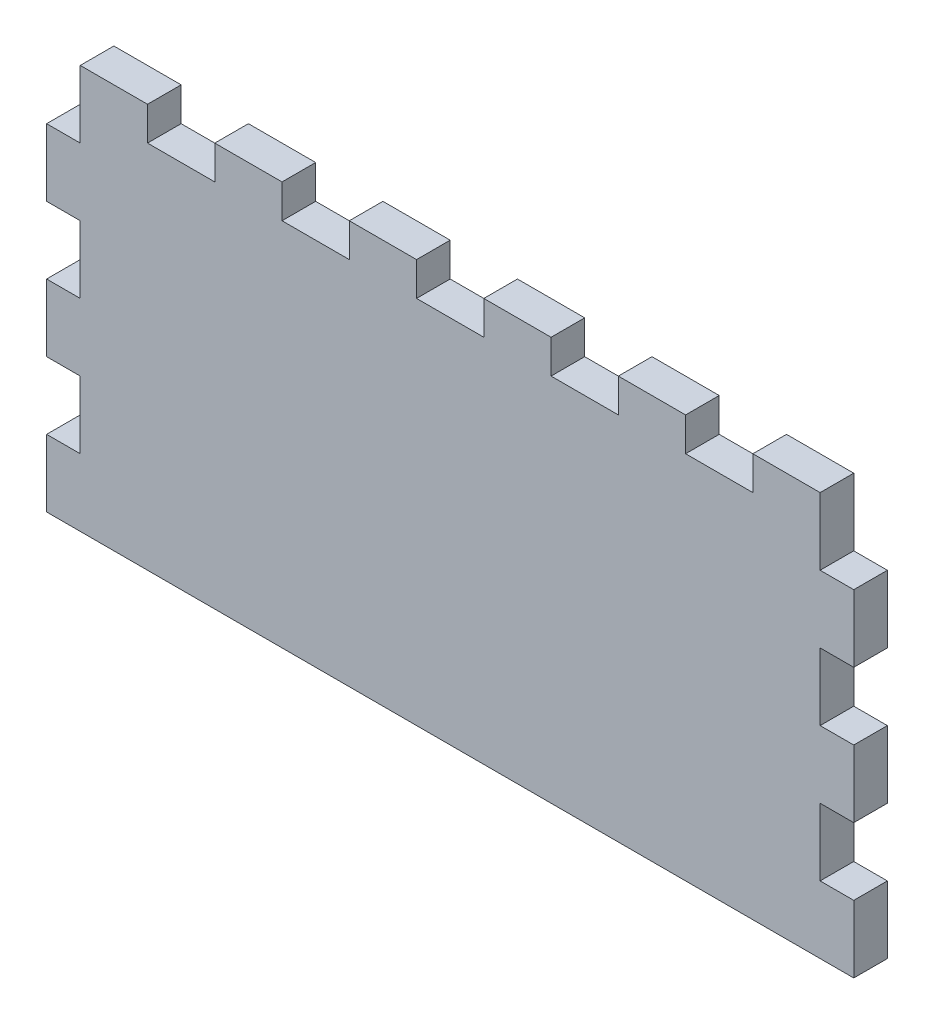
from build123d import *

# Parameters (mm, degrees)
SKETCH_1_W               = 120
SKETCH_1_H               = 60
EXTRUDE_1_DEPTH          = 5
CUT_EXTRUDE_1_REACH      = 69.268
SKETCH_2_W               = 5
SKETCH_2_H               = 10
PATTERN_LINEAR_1_COUNT   = 3
PATTERN_LINEAR_1_PITCH   = 20
MIRROR_1_COPY_1_REACH    = 69.268
MIRROR_1_COPY_1_SKETCH_W = 5
MIRROR_1_COPY_1_SKETCH_H = 10
MIRROR_1_COPY_2_REACH    = 69.268
MIRROR_1_COPY_2_SKETCH_W = 5
MIRROR_1_COPY_2_SKETCH_H = 10
CUT_EXTRUDE_2_REACH      = 69.268
SKETCH_3_W               = 10
SKETCH_3_H               = 5
PATTERN_LINEAR_2_COUNT   = 3
PATTERN_LINEAR_2_PITCH   = 20
PATTERN_LINEAR_3_COUNT   = 3
PATTERN_LINEAR_3_PITCH   = 20


with BuildPart() as part:
    # 스케치1 → 보스-돌출1 (new body)
    with BuildSketch(Plane.XY):
        Rectangle(SKETCH_1_W, SKETCH_1_H)
    extrude(amount=EXTRUDE_1_DEPTH)

    # 스케치2 → 컷-돌출1 (cut, up to next)
    with BuildSketch(Plane.XY.offset(5), mode=Mode.PRIVATE) as cut_extrude_1_sk1:
        with Locations((-57.5, 25)):
            Rectangle(SKETCH_2_W, SKETCH_2_H)
    cut_extrude_1_tool1 = extrude(cut_extrude_1_sk1.sketch, amount=-CUT_EXTRUDE_1_REACH, mode=Mode.PRIVATE) & part.part
    cut_extrude_1 = cut_extrude_1_tool1.solids().sort_by_distance((-57.5, 25, 5))[0]
    add(cut_extrude_1, mode=Mode.SUBTRACT)

    # 선형 패턴1: 컷-돌출1 ×3
    with Locations(*[(0, -i * PATTERN_LINEAR_1_PITCH, 0) for i in range(1, PATTERN_LINEAR_1_COUNT)]):
        add(cut_extrude_1, mode=Mode.SUBTRACT)

    # 대칭 복사1: 컷-돌출1 across plane
    add(cut_extrude_1.mirror(Plane(origin=(0, 0, 0), x_dir=(0, 0, 1), z_dir=(1, 0, 0))), mode=Mode.SUBTRACT)

    # 대칭 복사1 copy 1 sketch → 대칭 복사1 copy 1 (cut, up to next)
    with BuildSketch(Plane(origin=(0, -20, 5), x_dir=(-1, 0, 0), z_dir=(0, 0, 1)), mode=Mode.PRIVATE) as mirror_1_copy_1_sk1:
        with Locations((-57.5, -25)):
            Rectangle(MIRROR_1_COPY_1_SKETCH_W, MIRROR_1_COPY_1_SKETCH_H)
    mirror_1_copy_1_tool1 = extrude(mirror_1_copy_1_sk1.sketch, amount=-MIRROR_1_COPY_1_REACH, mode=Mode.PRIVATE) & part.part
    add(mirror_1_copy_1_tool1.solids().sort_by_distance((57.5, 5, 5))[0], mode=Mode.SUBTRACT)

    # 대칭 복사1 copy 2 sketch → 대칭 복사1 copy 2 (cut, up to next)
    with BuildSketch(Plane(origin=(0, -40, 5), x_dir=(-1, 0, 0), z_dir=(0, 0, 1)), mode=Mode.PRIVATE) as mirror_1_copy_2_sk1:
        with Locations((-57.5, -25)):
            Rectangle(MIRROR_1_COPY_2_SKETCH_W, MIRROR_1_COPY_2_SKETCH_H)
    mirror_1_copy_2_tool1 = extrude(mirror_1_copy_2_sk1.sketch, amount=-MIRROR_1_COPY_2_REACH, mode=Mode.PRIVATE) & part.part
    add(mirror_1_copy_2_tool1.solids().sort_by_distance((57.5, -15, 5))[0], mode=Mode.SUBTRACT)

    # 스케치3 → 컷-돌출2 (cut, up to next)
    with BuildSketch(Plane.XY.offset(5), mode=Mode.PRIVATE) as cut_extrude_2_sk1:
        with Locations((0, 27.5)):
            Rectangle(SKETCH_3_W, SKETCH_3_H)
    cut_extrude_2_tool1 = extrude(cut_extrude_2_sk1.sketch, amount=-CUT_EXTRUDE_2_REACH, mode=Mode.PRIVATE) & part.part
    cut_extrude_2 = cut_extrude_2_tool1.solids().sort_by_distance((0, 27.5, 5))[0]
    add(cut_extrude_2, mode=Mode.SUBTRACT)

    # 선형 패턴2: 컷-돌출2 ×3
    with Locations(*[(-i * PATTERN_LINEAR_2_PITCH, 0, 0) for i in range(1, PATTERN_LINEAR_2_COUNT)]):
        add(cut_extrude_2, mode=Mode.SUBTRACT)

    # 선형 패턴3: 컷-돌출2 ×3
    with Locations(*[(i * PATTERN_LINEAR_3_PITCH, 0, 0) for i in range(1, PATTERN_LINEAR_3_COUNT)]):
        add(cut_extrude_2, mode=Mode.SUBTRACT)


solid = part.part
